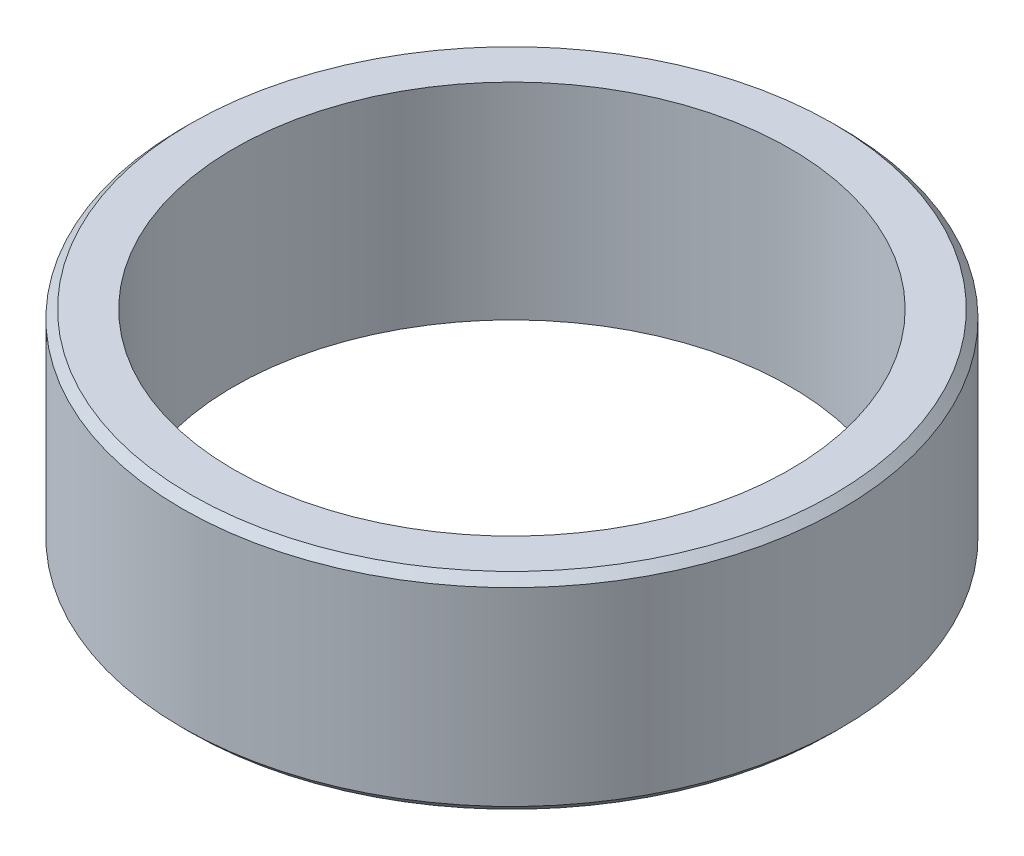
from build123d import *

# Parameters (mm, degrees)
SKETCH1_R           = 8
SKETCH1_R_2         = 6.75
BOSS_EXTRUDE1_DEPTH = 5
CHAMFER1_SIZE       = 0.2


with BuildPart() as part:
    # Sketch1 → Boss-Extrude1 (new body)
    with BuildSketch(Plane(origin=(0, 0, 0), x_dir=(1, 0, 0), z_dir=(0, 1, 0))):
        with Locations(Location((0, 0, 0), (0, 0, 270))):
            Circle(SKETCH1_R)
        with Locations(Location((0, 0, 0), (0, 0, 270))):
            Circle(SKETCH1_R_2, mode=Mode.SUBTRACT)
    extrude(amount=BOSS_EXTRUDE1_DEPTH)

    # Chamfer1
    chamfer1_edges = [part.edges().sort_by_distance(p)[0] for p in [
        (0, 0, -8),
        (0, 5, -8),
    ]]
    chamfer(chamfer1_edges, length=CHAMFER1_SIZE)


solid = part.part
